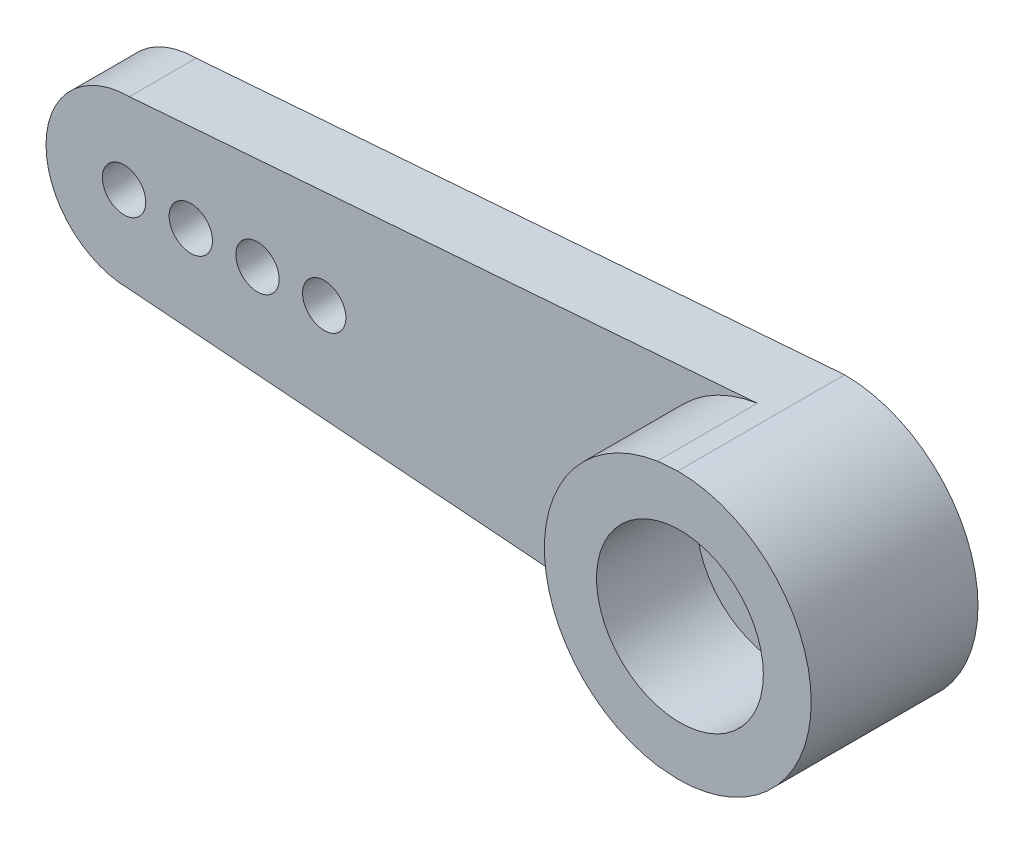
from build123d import *

# Parameters (mm, degrees)
BOSS_EXTRU_1_DEPTH      = 2.4
BOSS_EXTRU_2_DEPTH      = 6
ESQUISSE2_R             = 0.78
ENL_V_MAT_EXTRU_1_DEPTH = 51.646782553
ESQUISSE3_R             = 3.6
ENL_V_MAT_EXTRU_2_DEPTH = 0.6
ESQUISSE4_R             = 3
ENL_V_MAT_EXTRU_3_DEPTH = 3.6
ESQUISSE5_R             = 1.2
ENL_V_MAT_EXTRU_4_DEPTH = 3.6


with BuildPart() as part:
    # Esquisse1 → Boss.-Extru.1 (new body)
    with BuildSketch(Plane.XY):
        with BuildLine():
            ThreePointArc((-24.698480773, -4.743182356), (-28.762124109, 0), (-24.698480773, 4.743182356))
            Line((-24.698480773, 4.743182356), (-47.290124109, 3))
            ThreePointArc((-47.290124109, 3), (-50.290124109, 0), (-47.290124109, -3))
            Line((-47.290124109, -3), (-24.698480773, -4.743182356))
        make_face()
    extrude(amount=BOSS_EXTRU_1_DEPTH)

    # Esquisse1<3> → Boss.-Extru.2 (add)
    with BuildSketch(Plane.XY):
        with BuildLine():
            ThreePointArc((-23.962124109, -4.8), (-19.162124109, 0), (-23.962124109, 4.8))
            Line((-23.962124109, 4.8), (-24.698480773, 4.743182356))
            ThreePointArc((-24.698480773, 4.743182356), (-28.762124109, 0), (-24.698480773, -4.743182356))
            Line((-24.698480773, -4.743182356), (-23.962124109, -4.8))
        make_face()
    extrude(amount=BOSS_EXTRU_2_DEPTH)

    # Esquisse2 → Enlèv. mat.-Extru.1 (cut, through all)
    with BuildSketch(Plane.XY.offset(2.4)):
        with Locations((-47.481401961, 0)):
            Circle(ESQUISSE2_R)
        with Locations((-45.081401961, 0)):
            Circle(ESQUISSE2_R)
        with Locations((-42.681401961, 0)):
            Circle(ESQUISSE2_R)
        with Locations((-40.281401961, 0)):
            Circle(ESQUISSE2_R)
    extrude(amount=-ENL_V_MAT_EXTRU_1_DEPTH, mode=Mode.SUBTRACT)

    # Esquisse3 → Enlèv. mat.-Extru.2 (cut)
    with BuildSketch(Plane(origin=(0, 0, 0), x_dir=(-1, 0, 0), z_dir=(0, 0, -1))):
        with Locations((23.962124109, 0)):
            Circle(ESQUISSE3_R)
    extrude(amount=-ENL_V_MAT_EXTRU_2_DEPTH, mode=Mode.SUBTRACT)

    # Esquisse4 → Enlèv. mat.-Extru.3 (cut)
    with BuildSketch(Plane.XY.offset(6)):
        with Locations((-23.884137935, 0)):
            Circle(ESQUISSE4_R)
    extrude(amount=-ENL_V_MAT_EXTRU_3_DEPTH, mode=Mode.SUBTRACT)

    # Esquisse5 → Enlèv. mat.-Extru.4 (cut)
    with BuildSketch(Plane.XY.offset(2.4)):
        with Locations((-23.884137935, 0)):
            Circle(ESQUISSE5_R)
    extrude(amount=-ENL_V_MAT_EXTRU_4_DEPTH, mode=Mode.SUBTRACT)


solid = part.part
